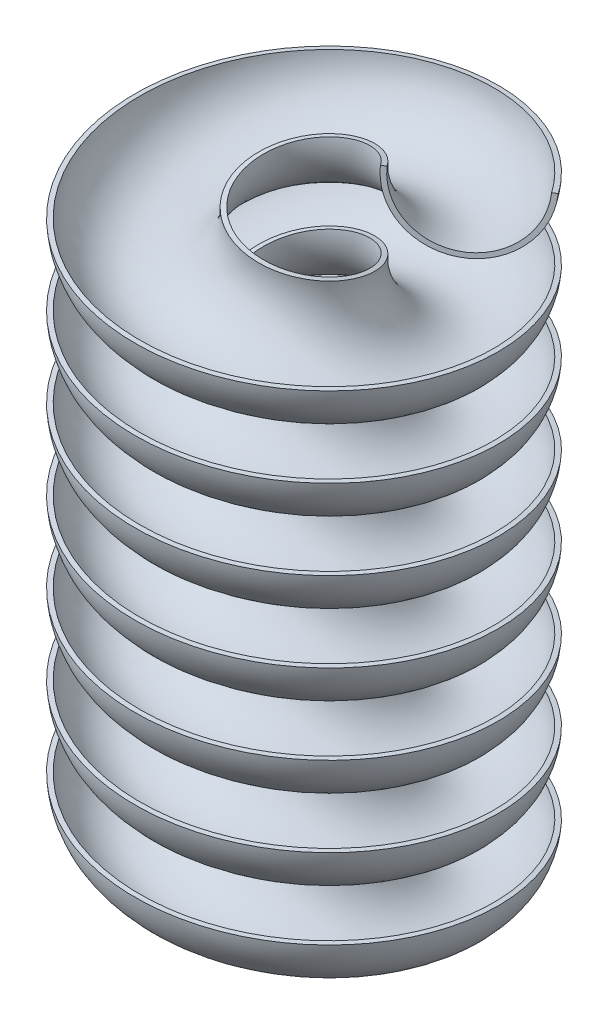
from build123d import *

# Parameters (mm, degrees)
SWEEP5_PITCH       = 337.837837838
SWEEP5_HEIGHT      = 2500
SWEEP5_RADIUS      = 500
SWEEP5_START_ANGLE = -90


with BuildPart() as part:
    # Sweep5: sweep along a helix
    with BuildLine() as sweep5_path:
        add(Helix(SWEEP5_PITCH, SWEEP5_HEIGHT, SWEEP5_RADIUS, center=(0, 0, 0), direction=(0, 1, 0), lefthand=True, mode=Mode.PRIVATE).rotate(Axis((0, 0, 0), (0, 1, 0)), SWEEP5_START_ANGLE))
    # Sketch3 → Sweep5 (sweep)
    with BuildSketch(Plane(origin=(404.508497187, 2500, -293.892626146), x_dir=(0.8114543527031922, -0.07700510941108282, -0.5793203315987024), z_dir=(0.5844158052953765, 0.10692067299656083, 0.8043793484463156))):
        with BuildLine():
            Line((-250, 0), (-270, 0))
            ThreePointArc((-270, 0), (0, -270), (270, 0))
            Line((270, 0), (250, 0))
            ThreePointArc((250, 0), (0, -250), (-250, 0))
        make_face()
    sweep(path=sweep5_path.line, is_frenet=True)


solid = part.part
